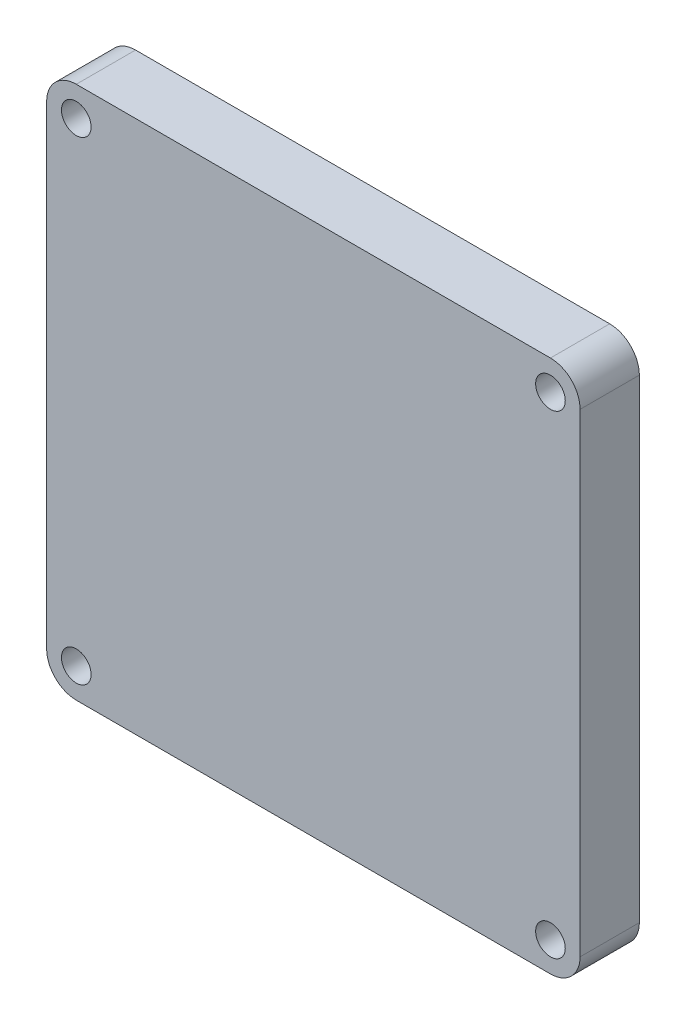
from build123d import *

# Parameters (mm, degrees)
SKETCH1_W           = 90
SKETCH1_H           = 90
BOSS_EXTRUDE1_DEPTH = 10
FILLET1_R           = 5
SKETCH2_R           = 2.5
CUT_EXTRUDE1_DEPTH  = 10


with BuildPart() as part:
    # Sketch1 → Boss-Extrude1 (new body)
    with BuildSketch(Plane.XY):
        Rectangle(SKETCH1_W, SKETCH1_H)
    extrude(amount=BOSS_EXTRUDE1_DEPTH)

    # Fillet1
    fillet1_edges = [part.edges().sort_by_distance(p)[0] for p in [
        (45, -45, 5),
        (-45, -45, 5),
        (-45, 45, 5),
        (45, 45, 5),
    ]]
    fillet(fillet1_edges, radius=FILLET1_R)

    # Sketch2 → Cut-Extrude1 (cut)
    with BuildSketch(Plane.XY.offset(10)):
        with Locations((-40, 40)):
            Circle(SKETCH2_R)
        with Locations((40, 40)):
            Circle(SKETCH2_R)
        with Locations((40, -40)):
            Circle(SKETCH2_R)
        with Locations((-40, -40)):
            Circle(SKETCH2_R)
    extrude(amount=-CUT_EXTRUDE1_DEPTH, mode=Mode.SUBTRACT)


solid = part.part
